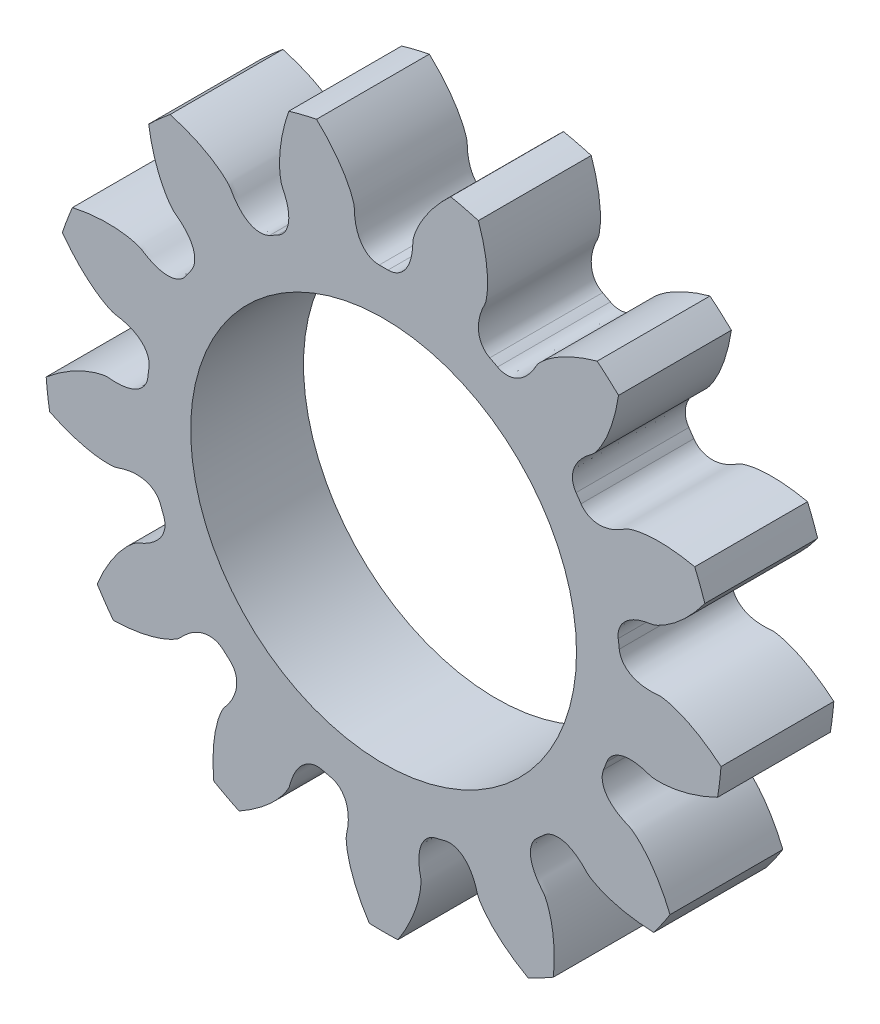
from build123d import *

# Parameters (mm, degrees)
GEAR_BASESKETCH_R                         = 19.05
NON_STANDARD_PITCHES_1_3000IN_P_D_DEPTH   = 3.175
TOOTH_CUT_D_P_10_0000_P_A_20_000DEG_DEPTH = 28.127211891
TOOTH_PATTERN_13_13_COUNT                 = 13
SKETCH1_R                                 = 10.8585
EXTRUDE1_DEPTH                            = 28.638554414


with BuildPart() as part:
    # Gear-BaseSketch → Non-standard pitches, 1.3000in P.D. (new, symmetric)
    with BuildSketch(Plane.XY):
        Circle(GEAR_BASESKETCH_R)
    extrude(amount=NON_STANDARD_PITCHES_1_3000IN_P_D_DEPTH, both=True)

    # Tooth-Sketch; Backlash: 0.0000in → Tooth-Cut, D.P.=10.0000, P.A.=20.000deg (cut, symmetric)
    with BuildSketch(Plane.XY):
        with BuildLine():
            ThreePointArc((-3.848123907, 18.742248793), (0, 19.133215815), (3.848123907, 18.742248793))
            add(Edge.make_bspline(
                [(3.848123907, 18.742248793), (3.721847674, 18.623079175), (3.478003914, 18.392958533), (3.145946183, 18.039256735), (2.853552974, 17.698392842), (2.60015953, 17.372000241), (2.383316311, 17.063284873), (2.200760912, 16.774866814), (2.049994663, 16.509274747), (1.928305441, 16.268827859), (1.833061471, 16.055619472), (1.760812379, 15.871606261), (1.709960419, 15.718300982), (1.629908483, 15.453519698), (1.644942968, 15.183129873), (1.613330997, 14.919877148), (1.594646659, 14.794792361), (1.563877215, 14.634950801), (1.514730254, 14.443536257), (1.43631308, 14.225464778), (1.336905979, 14.02087434), (1.212430405, 13.82972044), (1.056655347, 13.653956136), (0.861951582, 13.500358692), (0.623799994, 13.383320565), (0.40967144, 13.338204701), (0.281415938, 13.333876909), (0.24693607, 13.332713436)],
                knots=[0, 0, 0, 0, 0.076117063, 0.146984674, 0.212602832, 0.272971539, 0.328090793, 0.377960595, 0.422580946, 0.461951845, 0.496073292, 0.524945288, 0.548567833, 0.566940929, 0.645853261, 0.664795267, 0.683261933, 0.701285877, 0.73615521, 0.769795997, 0.802733439, 0.835672692, 0.869514682, 0.905270767, 0.94373674, 0.984874335, 1, 1, 1, 1], degree=3))
            ThreePointArc((0.24693607, 13.332713436), (0, 13.335), (-0.24693607, 13.332713436))
            add(Edge.make_bspline(
                [(-3.848123907, 18.742248793), (-3.721847674, 18.623079175), (-3.478003914, 18.392958533), (-3.145946183, 18.039256735), (-2.853552974, 17.698392842), (-2.60015953, 17.372000241), (-2.383316311, 17.063284873), (-2.200760912, 16.774866814), (-2.049994663, 16.509274747), (-1.928305441, 16.268827859), (-1.833061471, 16.055619472), (-1.760812379, 15.871606261), (-1.709960419, 15.718300982), (-1.629908483, 15.453519698), (-1.644942968, 15.183129873), (-1.613330997, 14.919877148), (-1.594646659, 14.794792361), (-1.563877215, 14.634950801), (-1.514730254, 14.443536257), (-1.43631308, 14.225464778), (-1.336905979, 14.02087434), (-1.212430405, 13.82972044), (-1.056655347, 13.653956136), (-0.861951582, 13.500358692), (-0.623799994, 13.383320565), (-0.40967144, 13.338204701), (-0.281415938, 13.333876909), (-0.24693607, 13.332713436)],
                knots=[0, 0, 0, 0, 0.076117063, 0.146984674, 0.212602832, 0.272971539, 0.328090793, 0.377960595, 0.422580946, 0.461951845, 0.496073292, 0.524945288, 0.548567833, 0.566940929, 0.645853261, 0.664795267, 0.683261933, 0.701285877, 0.73615521, 0.769795997, 0.802733439, 0.835672692, 0.869514682, 0.905270767, 0.94373674, 0.984874335, 1, 1, 1, 1], degree=3))
        make_face()
    tooth_cut_d_p_10_0000_p_a_20_000deg = extrude(amount=TOOTH_CUT_D_P_10_0000_P_A_20_000DEG_DEPTH, both=True, mode=Mode.SUBTRACT)

    # Tooth Pattern, 13 / 13: Tooth-Cut, D.P.=10.0000, P.A.=20.000deg ×13 about axis
    tooth_pattern_13_13_axis = Axis((0, 0, -88.99), (0, 0, 1))
    for i in range(1, TOOTH_PATTERN_13_13_COUNT):
        add(tooth_cut_d_p_10_0000_p_a_20_000deg.rotate(tooth_pattern_13_13_axis, i * 360 / TOOTH_PATTERN_13_13_COUNT), mode=Mode.SUBTRACT)

    # Sketch1 → Extrude1 (cut, through all)
    with BuildSketch(Plane.XY.offset(3.175)):
        Circle(SKETCH1_R)
    extrude(amount=-EXTRUDE1_DEPTH, mode=Mode.SUBTRACT)


solid = part.part
